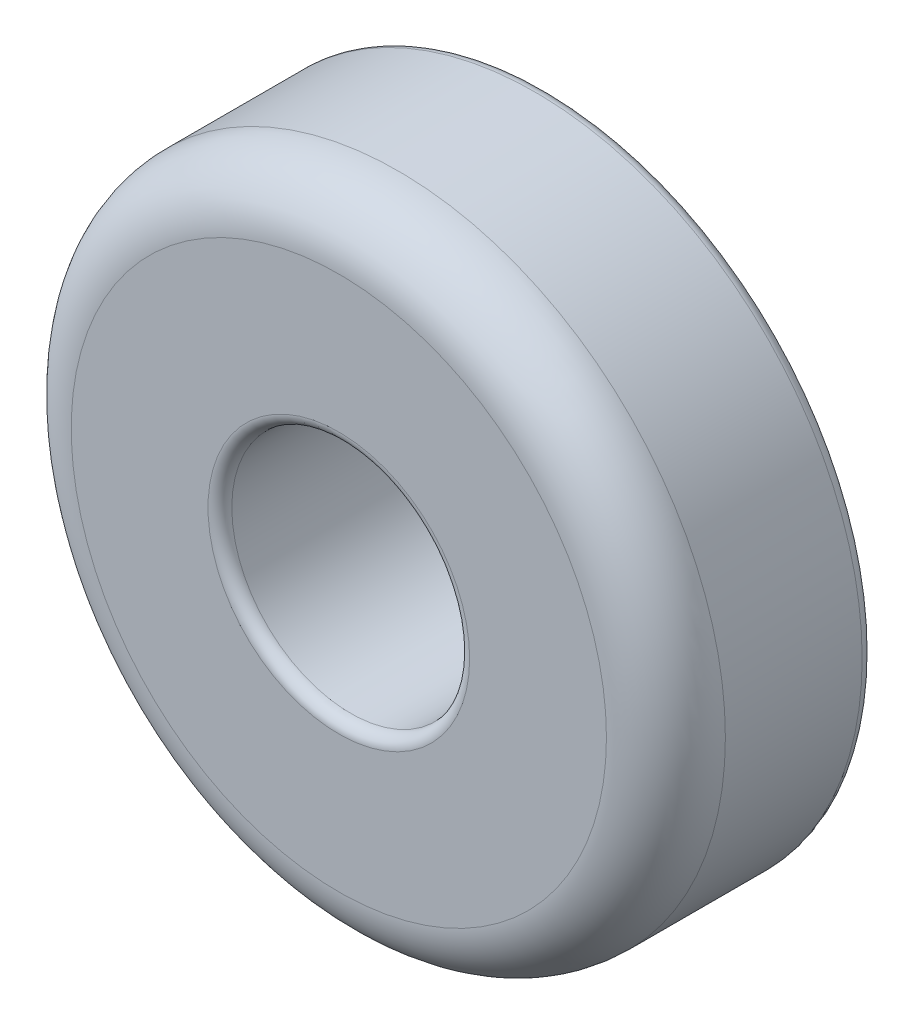
from build123d import *

# Parameters (mm, degrees)
SKETCH1_R           = 2.75
SKETCH1_R_2         = 1
EXTRUDE_THIN1_DEPTH = 1.75
FILLET1_R           = 0.5
FILLET2_R           = 0.1
SCALE1_SCALE        = 0.445


with BuildPart() as part:
    # Sketch1 → Extrude-Thin1 (new body)
    with BuildSketch(Plane.XY):
        Circle(SKETCH1_R)
        Circle(SKETCH1_R_2, mode=Mode.SUBTRACT)
    extrude(amount=EXTRUDE_THIN1_DEPTH)

    # Fillet1
    fillet1_edges = [part.edges().sort_by_distance(p)[0] for p in [
        (-2.75, 0, 1.75),
    ]]
    fillet(fillet1_edges, radius=FILLET1_R)

    # Fillet2
    fillet2_edges = [part.edges().sort_by_distance(p)[0] for p in [
        (-2.75, 0, 0),
        (-1, 0, 0),
        (-1, 0, 1.75),
    ]]
    fillet(fillet2_edges, radius=FILLET2_R)


with BuildPart() as part_1:
    # Scale1: scaled about (0, 0, 0.856615471)
    add(part.part.scale(SCALE1_SCALE).moved(Location((0, 0, 0.475421586))))


solid = part_1.part
